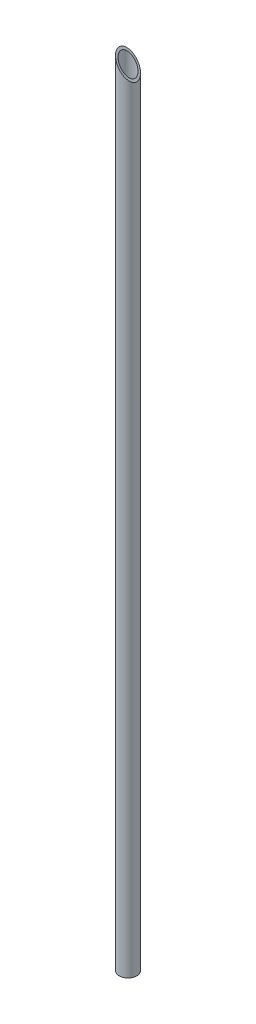
from build123d import *

# Parameters (mm, degrees)
SKETCH1_R               = 0.5
EXTRUDE1_DEPTH          = 45
SHELL1_T                = -0.1
CUT_EXTRUDE1_DEPTH      = 45
CUT_EXTRUDE1_DEPTH_BACK = 45


with BuildPart() as part:
    # Sketch1 → Extrude1 (new body)
    with BuildSketch(Plane(origin=(0, 0, 0), x_dir=(1, 0, 0), z_dir=(0, 1, 0))):
        Circle(SKETCH1_R)
    extrude(amount=EXTRUDE1_DEPTH)

    # Shell1
    shell1_openings = [part.faces().sort_by_distance(p)[0] for p in [
        (0, 0, 0),
        (0, 45, 0),
    ]]
    offset(amount=SHELL1_T, openings=shell1_openings, kind=Kind.INTERSECTION)

    # Sketch2 → Cut-Extrude1 (cut, two sides: drawn at the far end of the back side and taken through both)
    with BuildSketch(Plane.XY.offset(-CUT_EXTRUDE1_DEPTH_BACK)):
        Polygon((-0.5, 45), (3.966783564, 39.557315291), (3.966783564, 46.045953815), align=None)
    extrude(amount=CUT_EXTRUDE1_DEPTH + CUT_EXTRUDE1_DEPTH_BACK, mode=Mode.SUBTRACT)


solid = part.part
